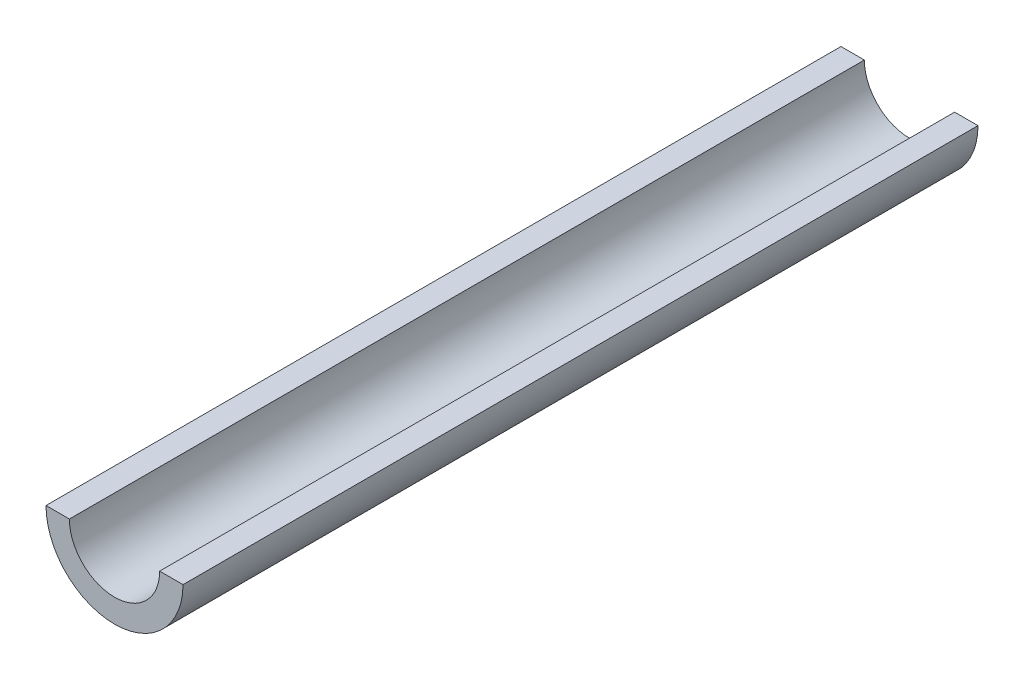
from build123d import *

# Parameters (mm, degrees)
BOSS_EXTRUDE1_DEPTH = 170


with BuildPart() as part:
    # Sketch1 → Boss-Extrude1 (new body)
    with BuildSketch(Plane.XY):
        with BuildLine():
            Line((14.65, 0), (9.65, 0))
            ThreePointArc((9.65, 0), (0, -9.65), (-9.65, 0))
            Line((-9.65, 0), (-14.65, 0))
            ThreePointArc((-14.65, 0), (0, -14.65), (14.65, 0))
        make_face()
    extrude(amount=BOSS_EXTRUDE1_DEPTH)


solid = part.part
